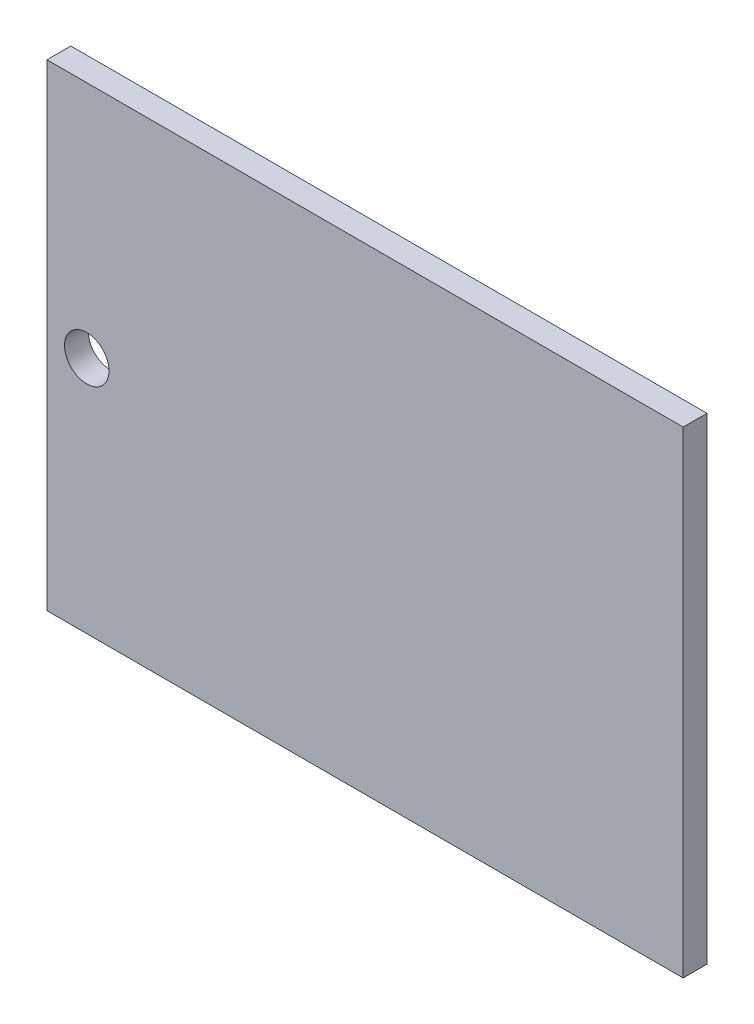
from build123d import *

# Parameters (mm, degrees)
SKETCH1_W           = 40
SKETCH1_H           = 30
BOSS_EXTRUDE2_DEPTH = 1.5
SKETCH2_R           = 1.4
CUT_EXTRUDE1_DEPTH  = 26.044959573


with BuildPart() as part:
    # Sketch1 → Boss-Extrude2 (new body)
    with BuildSketch(Plane.XY):
        Rectangle(SKETCH1_W, SKETCH1_H)
    extrude(amount=BOSS_EXTRUDE2_DEPTH)

    # Sketch2 → Cut-Extrude1 (cut, through all)
    with BuildSketch(Plane.XY.offset(1.5)):
        with Locations((-17.5, 0)):
            Circle(SKETCH2_R)
    extrude(amount=-CUT_EXTRUDE1_DEPTH, mode=Mode.SUBTRACT)


solid = part.part
